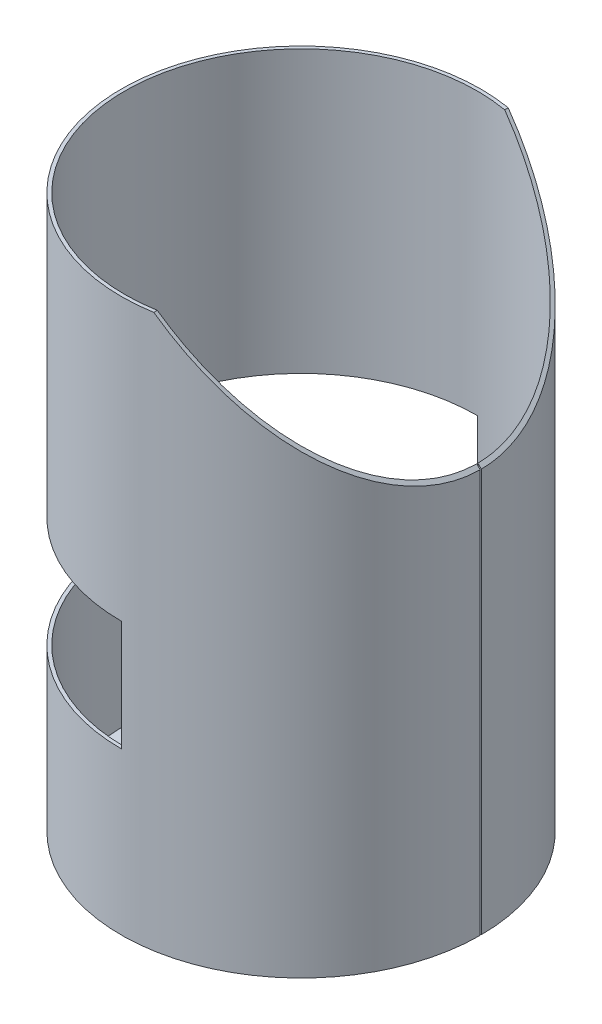
from build123d import *

# Parameters (mm, degrees)
ESQUISSE1_R                  = 156
BOSS_EXTRU_1_DEPTH           = 520
COQUE1_T                     = 3
ENL_V_MAT_EXTRU_1_DEPTH      = 565.864585542
ENL_V_MAT_EXTRU_1_DEPTH_BACK = 565.864585542
ESQUISSE3_W                  = 1
ESQUISSE3_H                  = 353.000816996
ENL_V_MAT_EXTRU_2_DEPTH      = 529.272656873


with BuildPart() as part:
    # Esquisse1 → Boss.-Extru.1 (new body)
    with BuildSketch(Plane(origin=(0, 0, 0), x_dir=(1, 0, 0), z_dir=(0, 1, 0))):
        with Locations(Location((0, 0, 0), (0, 0, 270))):
            Circle(ESQUISSE1_R)
    extrude(amount=BOSS_EXTRU_1_DEPTH)

    # Coque1 (no face opened: a closed hollow body)
    add(offset(amount=-COQUE1_T, mode=Mode.PRIVATE), mode=Mode.SUBTRACT)

    # Esquisse2 → Enlèv. mat.-Extru.1 (cut, two sides: drawn at the far end of the back side and taken through both)
    with BuildSketch(Plane.XY.offset(-ENL_V_MAT_EXTRU_1_DEPTH_BACK)):
        Polygon((0, 140), (-156.821895425, 140), (-156, 236), (0, 236), align=None)
        Polygon((-156, 520), (-156, 480), (26, 480), (156, 350), (156, 520), align=None)
    extrude(amount=ENL_V_MAT_EXTRU_1_DEPTH + ENL_V_MAT_EXTRU_1_DEPTH_BACK, mode=Mode.SUBTRACT)

    # Esquisse3 → Enlèv. mat.-Extru.2 (cut, through all)
    with BuildSketch(Plane(origin=(0, 0, 0), x_dir=(0, 0, -1), z_dir=(1, 0, 0))):
        with Locations((0, 176.500408498)):
            Rectangle(ESQUISSE3_W, ESQUISSE3_H)
    extrude(amount=ENL_V_MAT_EXTRU_2_DEPTH, mode=Mode.SUBTRACT)


solid = part.part
